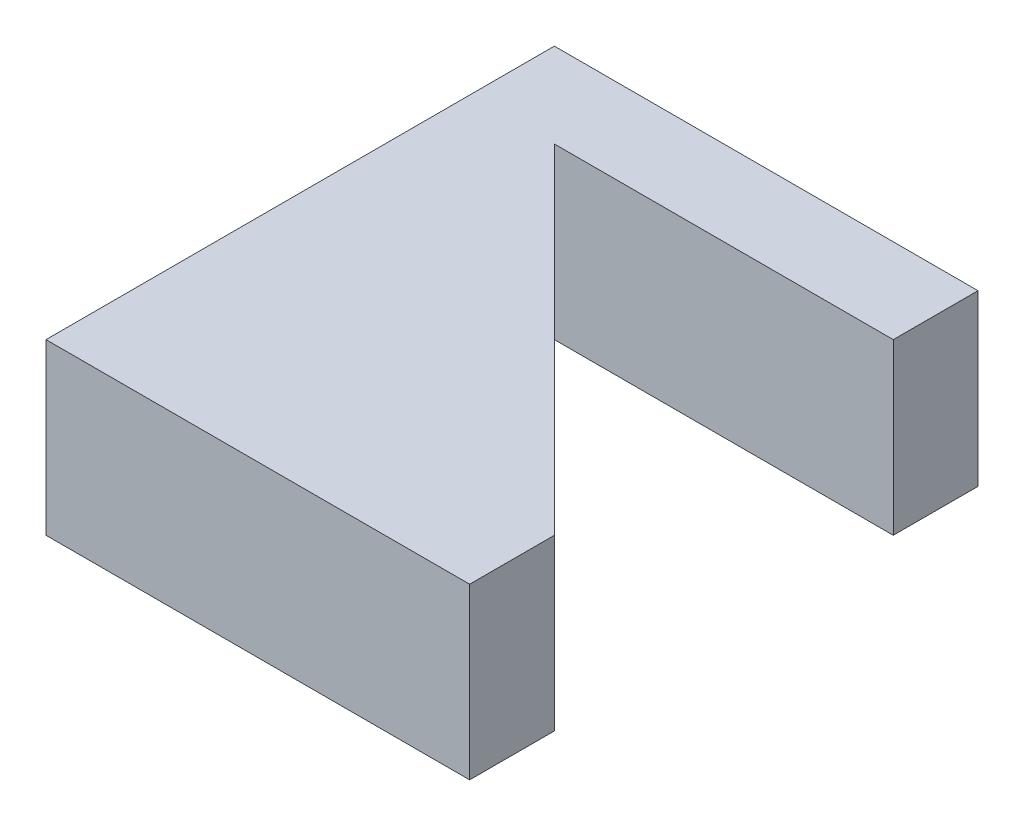
from build123d import *

# Parameters (mm, degrees)
BOSS_EXTRUDE1_DEPTH = 20


with BuildPart() as part:
    # Sketch1 → Boss-Extrude1 (new body)
    with BuildSketch(Plane(origin=(0, 0, 0), x_dir=(1, 0, 0), z_dir=(0, 1, 0))):
        Polygon((0, 0), (0, -60), (50, -60), (50, -50), (10, -10), (50, -10), (50, 0), align=None)
    extrude(amount=BOSS_EXTRUDE1_DEPTH)


solid = part.part
